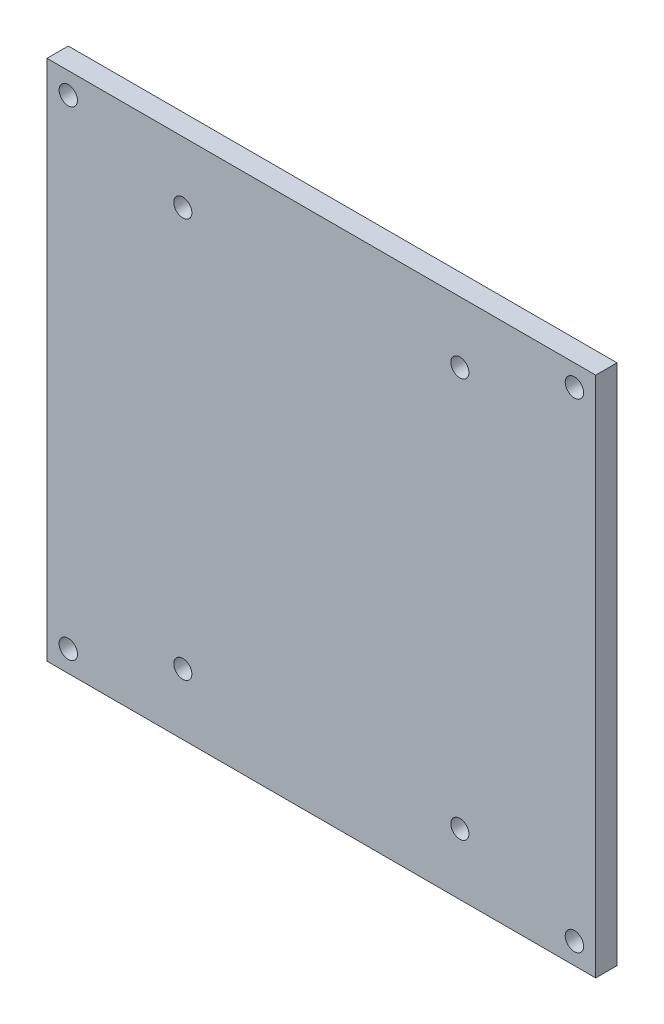
from build123d import *

# Parameters (mm, degrees)
SKETCH_1_W          = 103
SKETCH_1_H          = 98
EXTRUDE_1_DEPTH     = 4
SKETCH_2_R          = 1.725
CUT_EXTRUDE_1_DEPTH = 4
SKETCH_3_R          = 1.7
CUT_EXTRUDE_2_DEPTH = 4


with BuildPart() as part:
    # Эскиз1 → Бобышка-Вытянуть1 (new body)
    with BuildSketch(Plane.XY):
        Rectangle(SKETCH_1_W, SKETCH_1_H)
    extrude(amount=EXTRUDE_1_DEPTH)

    # Эскиз2 → Вырез-Вытянуть1 (cut)
    with BuildSketch(Plane.XY.offset(4)):
        with Locations((-47.5, 45)):
            Circle(SKETCH_2_R)
        with Locations((47.5, 45)):
            Circle(SKETCH_2_R)
        with Locations((47.5, -45)):
            Circle(SKETCH_2_R)
        with Locations((-47.5, -45)):
            Circle(SKETCH_2_R)
    extrude(amount=-CUT_EXTRUDE_1_DEPTH, mode=Mode.SUBTRACT)

    # Эскиз3 → Вырез-Вытянуть2 (cut)
    with BuildSketch(Plane.XY.offset(4)):
        with Locations((-26, 37.5)):
            Circle(SKETCH_3_R)
        with Locations((26, 37.5)):
            Circle(SKETCH_3_R)
        with Locations((-26, -37.5)):
            Circle(SKETCH_3_R)
        with Locations((26, -37.5)):
            Circle(SKETCH_3_R)
    extrude(amount=-CUT_EXTRUDE_2_DEPTH, mode=Mode.SUBTRACT)


solid = part.part
